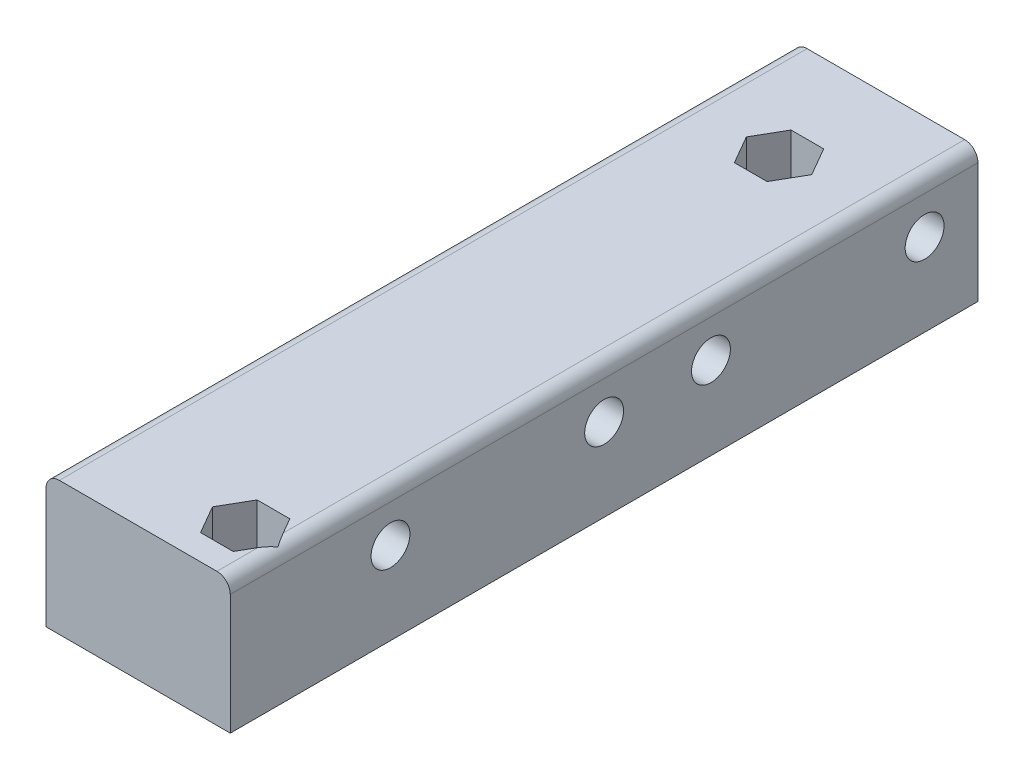
from build123d import *

# Parameters (mm, degrees)
SKETCH1_W           = 21.9075
SKETCH1_H           = 15.875
BOSS_EXTRUDE1_DEPTH = 101.6
FILLET1_R           = 1.5875
SKETCH2_R           = 2.3114
CUT_EXTRUDE2_DEPTH  = 21.9075
CUT_EXTRUDE3_REACH  = 107.14
SKETCH4_W           = 21.9075
SKETCH4_H           = 15.875
CUT_EXTRUDE4_DEPTH  = 12.7


with BuildPart() as part:
    # Sketch1 → Boss-Extrude1 (new body)
    with BuildSketch(Plane.XY):
        with Locations((10.95375, 7.9375)):
            Rectangle(SKETCH1_W, SKETCH1_H)
    extrude(amount=BOSS_EXTRUDE1_DEPTH)

    # Fillet1
    fillet1_edges = [part.edges().sort_by_distance(p)[0] for p in [
        (0, 15.875, 50.8),
        (21.9075, 15.875, 50.8),
    ]]
    fillet(fillet1_edges, radius=FILLET1_R)

    # Sketch2 → Cut-Extrude2 (cut)
    with BuildSketch(Plane(origin=(21.9075, 0, 0), x_dir=(0, 0, -1), z_dir=(1, 0, 0))):
        with Locations((-57.15, 9.8298)):
            Circle(SKETCH2_R)
        with Locations((-44.45, 9.8298)):
            Circle(SKETCH2_R)
        with Locations((-82.55, 9.8298)):
            Circle(SKETCH2_R)
        with Locations((-6.35, 9.8298)):
            Circle(SKETCH2_R)
        with Locations((-19.05, 9.8298)):
            Circle(SKETCH2_R)
    extrude(amount=-CUT_EXTRUDE2_DEPTH, mode=Mode.SUBTRACT)

    # Sketch3 → Cut-Extrude3 (cut, up to next)
    with BuildSketch(Plane.XZ, mode=Mode.PRIVATE) as cut_extrude3_sk1:
        Polygon((19.246822331, 98.58883), (15.360677669, 98.58883), (13.417605338, 95.22333), (15.360677669, 91.85783), (19.246822331, 91.85783), (21.189894662, 95.22333), align=None)
    cut_extrude3_tool1 = extrude(cut_extrude3_sk1.sketch, amount=-CUT_EXTRUDE3_REACH, mode=Mode.PRIVATE) & part.part
    # Sketch3 → Cut-Extrude3 (cut, up to next)
    with BuildSketch(Plane.XZ, mode=Mode.PRIVATE) as cut_extrude3_sk2:
        Polygon((12.896822331, 28.7655), (9.010677669, 28.7655), (7.067605338, 25.4), (9.010677669, 22.0345), (12.896822331, 22.0345), (14.839894662, 25.4), align=None)
    cut_extrude3_tool2 = extrude(cut_extrude3_sk2.sketch, amount=-CUT_EXTRUDE3_REACH, mode=Mode.PRIVATE) & part.part
    add(cut_extrude3_tool1.solids().sort_by_distance((17.30375, 0, 95.22333))[0], mode=Mode.SUBTRACT)
    add(cut_extrude3_tool2.solids().sort_by_distance((10.95375, 0, 25.4))[0], mode=Mode.SUBTRACT)

    # Sketch4 → Cut-Extrude4 (cut)
    with BuildSketch(Plane(origin=(0, 0, 0), x_dir=(-1, 0, 0), z_dir=(0, 0, -1))):
        with Locations((-10.95375, 7.9375)):
            Rectangle(SKETCH4_W, SKETCH4_H)
    extrude(amount=-CUT_EXTRUDE4_DEPTH, mode=Mode.SUBTRACT)


solid = part.part
